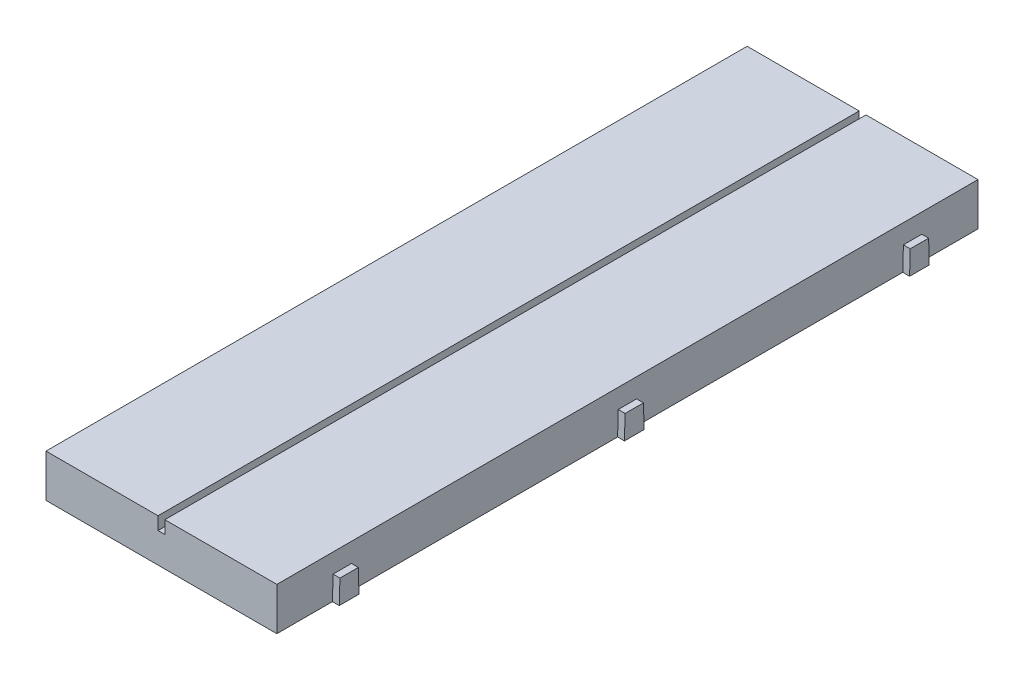
from build123d import *

# Parameters (mm, degrees)
BOSS_EXTRUDE1_DEPTH = 164
BOSS_EXTRUDE2_DEPTH = 1.6


with BuildPart() as part:
    # Sketch1 → Boss-Extrude1 (new body)
    with BuildSketch(Plane.XY):
        Polygon((-27, 10), (-27, 0), (27, 0), (27, 10), (0.8, 10), (0.8, 7), (-0.8, 7), (-0.8, 10), align=None)
    extrude(amount=BOSS_EXTRUDE1_DEPTH)

    # Sketch2 → Boss-Extrude2 (add)
    with BuildSketch(Plane(origin=(27, 0, 0), x_dir=(0, 0, -1), z_dir=(1, 0, 0))):
        Polygon((-151, 0), (-150.85, 5.5), (-146.55, 5.5), (-146.4, 0), align=None)
        Polygon((-13.15, 5.5), (-17.45, 5.5), (-17.6, 0), (-13, 0), align=None)
        Polygon((-84.3, 0), (-84.15, 5.5), (-79.85, 5.5), (-79.7, 0), align=None)
    boss_extrude2 = extrude(amount=BOSS_EXTRUDE2_DEPTH)

    # Mirror1: Boss-Extrude2 across plane
    add(boss_extrude2.mirror(Plane(origin=(0, 0, 0), x_dir=(0, 0, 1), z_dir=(1, 0, 0))))


solid = part.part
